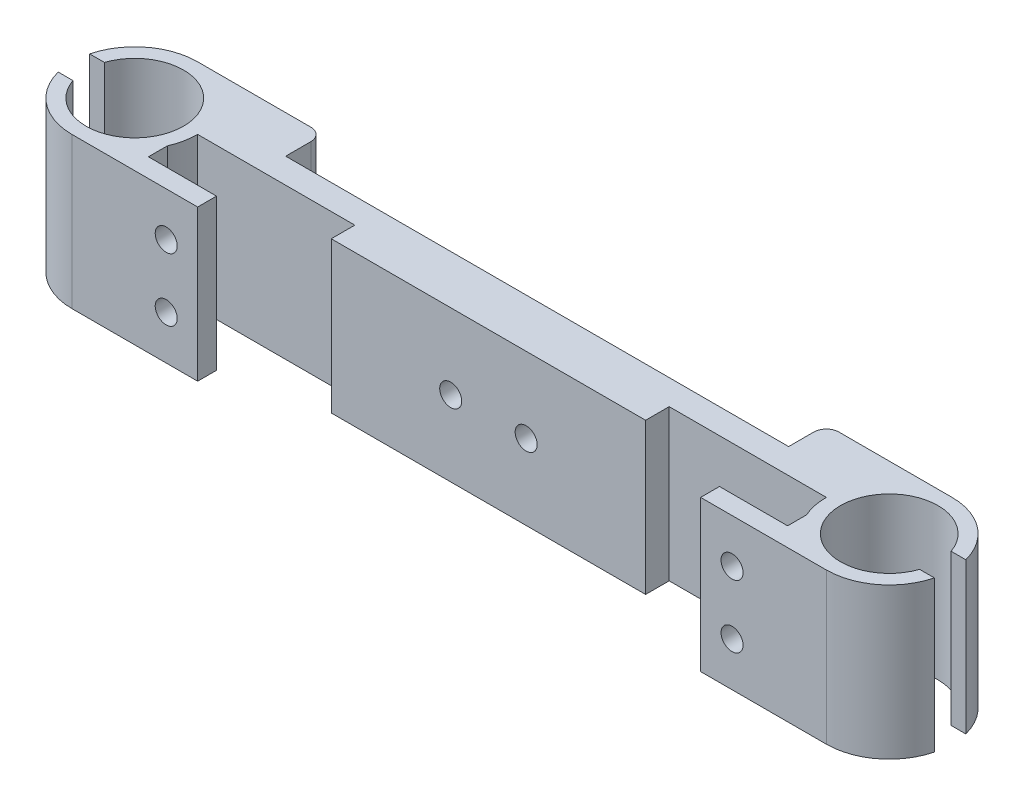
from build123d import *

# Parameters (mm, degrees)
SKETCH_1_R          = 7.75
EXTRUDE_1_DEPTH     = 24
EXTRUDE_START       = -24
EXTRUDE_2_DEPTH     = 24
SKETCH_3_W          = 50
SKETCH_3_H          = 3.75
EXTRUDE_3_DEPTH     = 24
SKETCH_4_W          = 80
SKETCH_4_H          = 6
CUT_EXTRUDE_1_DEPTH = 24
FILLET_1_R          = 2
SKETCH_5_W          = 7.752834923
SKETCH_5_H          = 5
CUT_EXTRUDE_2_DEPTH = 24
SKETCH_6_R          = 1.75
CUT_EXTRUDE_3_DEPTH = 24
SKETCH_7_R          = 1.75
CUT_EXTRUDE_4_DEPTH = 3
SKETCH_8_W          = 10.83484861
SKETCH_8_H          = 3
CUT_EXTRUDE_5_DEPTH = 75.375029438
SKETCH_9_R          = 1.75
CUT_EXTRUDE_6_DEPTH = 3
SKETCH_10_R         = 3
CUT_EXTRUDE_7_DEPTH = 4


with BuildPart() as part:
    # 草图1 → 凸台-拉伸1 (new body)
    with BuildSketch(Plane(origin=(0, 0, 0), x_dir=(1, 0, 0), z_dir=(0, 1, 0))):
        with BuildLine():
            Line((-50.83484861, -4), (50.83484861, -4))
            ThreePointArc((50.83484861, -4), (65.477225575, 8.366600265), (60, -10))
            Line((60, -10), (-60, -10))
            ThreePointArc((-60, -10), (-65.477225575, 8.366600265), (-50.83484861, -4))
        make_face()
        with Locations(Location((-60, 0, 0), (0, 0, 270))):
            Circle(SKETCH_1_R, mode=Mode.SUBTRACT)
        with Locations(Location((60, 0, 0), (0, 0, 270))):
            Circle(SKETCH_1_R, mode=Mode.SUBTRACT)
    extrude(amount=EXTRUDE_1_DEPTH)

    # 草图2 → 凸台-拉伸2 (add)
    with BuildSketch(Plane(origin=(0, 24, 0), x_dir=(1, 0, 0), z_dir=(0, 1, 0)).offset(EXTRUDE_START)):
        with BuildLine():
            ThreePointArc((-60, 10), (-52.928932188, 7.071067812), (-50, 0))
            Line((-50, 0), (50, 0))
            ThreePointArc((50, 0), (52.928932188, 7.071067812), (60, 10))
            Line((60, 10), (-60, 10))
        make_face()
    extrude(amount=EXTRUDE_2_DEPTH)

    # 草图3 → 凸台-拉伸3 (add)
    with BuildSketch(Plane.XZ):
        with Locations((0, 1.875)):
            Rectangle(SKETCH_3_W, SKETCH_3_H)
    extrude(amount=-EXTRUDE_3_DEPTH)

    # 草图4 → 切除-拉伸1 (cut)
    with BuildSketch(Plane.XZ):
        with Locations((0, 7)):
            Rectangle(SKETCH_4_W, SKETCH_4_H)
        with Locations((0, -7)):
            Rectangle(SKETCH_4_W, SKETCH_4_H)
    extrude(amount=-CUT_EXTRUDE_1_DEPTH, mode=Mode.SUBTRACT)

    # 圆角1
    fillet_1_edges = [part.edges().sort_by_distance(p)[0] for p in [
        (40, 12, -10),
        (-40, 12, -10),
    ]]
    fillet(fillet_1_edges, radius=FILLET_1_R)

    # 草图5 → 切除-拉伸2 (cut)
    with BuildSketch(Plane.XZ):
        with Locations((68.12542242, 0)):
            Rectangle(SKETCH_5_W, SKETCH_5_H)
        with Locations((-68.12542242, 0)):
            Rectangle(SKETCH_5_W, SKETCH_5_H)
    extrude(amount=-CUT_EXTRUDE_2_DEPTH, mode=Mode.SUBTRACT)

    # 草图6 → 切除-拉伸3 (cut)
    with BuildSketch(Plane(origin=(0, 0, -4), x_dir=(-1, 0, 0), z_dir=(0, 0, -1))):
        with Locations((-6, 12)):
            Circle(SKETCH_6_R)
        with Locations((6, 12)):
            Circle(SKETCH_6_R)
    extrude(amount=-CUT_EXTRUDE_3_DEPTH, mode=Mode.SUBTRACT)

    # 草图7 → 切除-拉伸4 (cut)
    with BuildSketch(Plane.XY.offset(10)):
        with Locations((45, 7)):
            Circle(SKETCH_7_R)
        with Locations((45, 17)):
            Circle(SKETCH_7_R)
    extrude(amount=-CUT_EXTRUDE_4_DEPTH, mode=Mode.SUBTRACT)

    # 草图8 → 切除-拉伸5 (cut, through all)
    with BuildSketch(Plane.XZ):
        with Locations((45.417424305, 5.5)):
            Rectangle(SKETCH_8_W, SKETCH_8_H)
        with Locations((-45.417424305, 5.5)):
            Rectangle(SKETCH_8_W, SKETCH_8_H)
    extrude(amount=-CUT_EXTRUDE_5_DEPTH, mode=Mode.SUBTRACT)

    # 草图9 → 切除-拉伸6 (cut)
    with BuildSketch(Plane.XY.offset(10)):
        with Locations((-45, 7)):
            Circle(SKETCH_9_R)
        with Locations((-45, 17)):
            Circle(SKETCH_9_R)
    extrude(amount=-CUT_EXTRUDE_6_DEPTH, mode=Mode.SUBTRACT)

    # 草图10 → 切除-拉伸7 (cut)
    with BuildSketch(Plane(origin=(0, 0, -4), x_dir=(-1, 0, 0), z_dir=(0, 0, -1))):
        with Locations((6, 12)):
            Circle(SKETCH_10_R)
        with Locations((-6, 12)):
            Circle(SKETCH_10_R)
    extrude(amount=-CUT_EXTRUDE_7_DEPTH, mode=Mode.SUBTRACT)


solid = part.part
